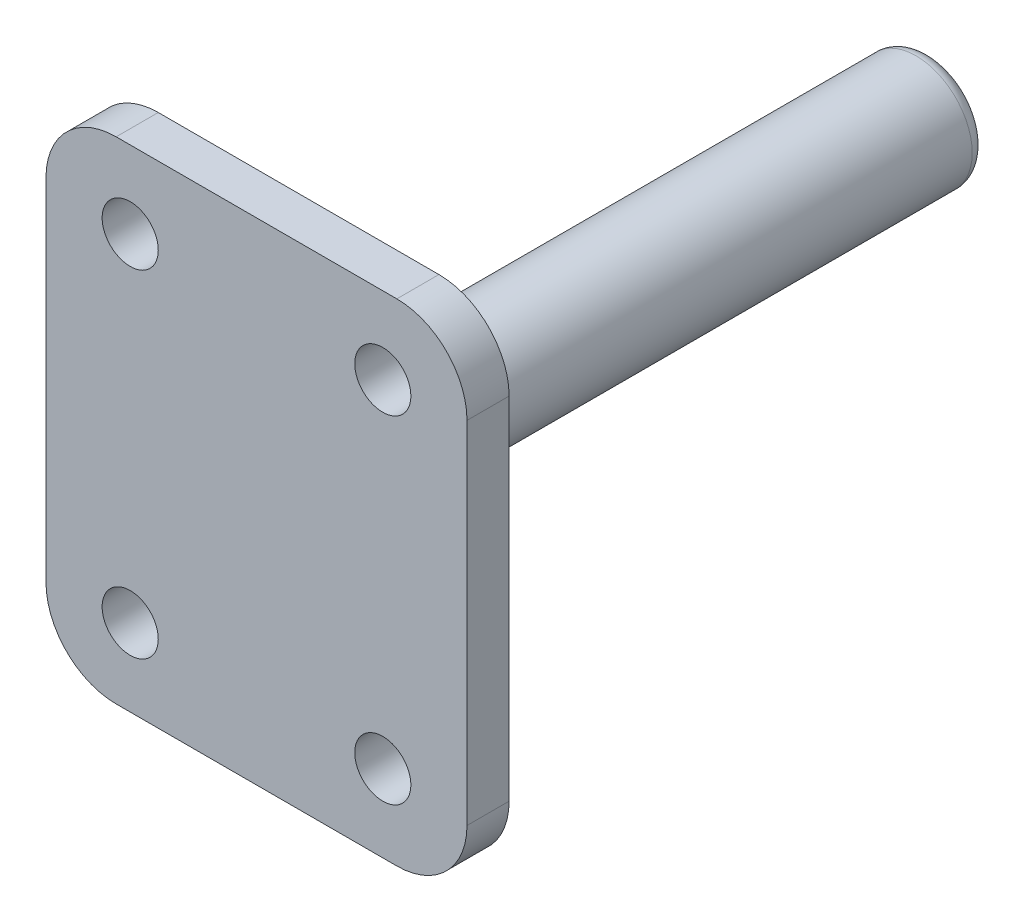
from build123d import *

# Parameters (mm, degrees)
SKETCH2_W           = 30
SKETCH2_H           = 35
BOSS_EXTRUDE1_DEPTH = 3
FILLET1_R           = 5
SKETCH3_R           = 2
CUT_EXTRUDE1_DEPTH  = 10
SKETCH6_R           = 4
BOSS_EXTRUDE2_DEPTH = 45
FILLET2_R           = 1


with BuildPart() as part:
    # Sketch2 → Boss-Extrude1 (new body)
    with BuildSketch(Plane.XY):
        with Locations((15, -17.5)):
            Rectangle(SKETCH2_W, SKETCH2_H)
    extrude(amount=BOSS_EXTRUDE1_DEPTH)

    # Fillet1
    fillet1_edges = [part.edges().sort_by_distance(p)[0] for p in [
        (0, 0, 1.5),
        (30, 0, 1.5),
        (30, -35, 1.5),
        (0, -35, 1.5),
    ]]
    fillet(fillet1_edges, radius=FILLET1_R)

    # Sketch3 → Cut-Extrude1 (cut)
    with BuildSketch(Plane.XY.offset(3)):
        with Locations((6, -5.5)):
            Circle(SKETCH3_R)
        with Locations((24, -5.5)):
            Circle(SKETCH3_R)
        with Locations((6, -29.5)):
            Circle(SKETCH3_R)
        with Locations((24, -29.5)):
            Circle(SKETCH3_R)
    extrude(amount=-CUT_EXTRUDE1_DEPTH, mode=Mode.SUBTRACT)

    # Sketch6 → Boss-Extrude2 (add)
    with BuildSketch(Plane(origin=(0, 0, 0), x_dir=(-1, 0, 0), z_dir=(0, 0, -1))):
        with Locations(Location((-15, -17.5, 0), (0, 0, 180))):
            Circle(SKETCH6_R)
    extrude(amount=BOSS_EXTRUDE2_DEPTH)

    # Fillet2
    fillet2_edges = [part.edges().sort_by_distance(p)[0] for p in [
        (11, -17.5, -45),
    ]]
    fillet(fillet2_edges, radius=FILLET2_R)


solid = part.part
